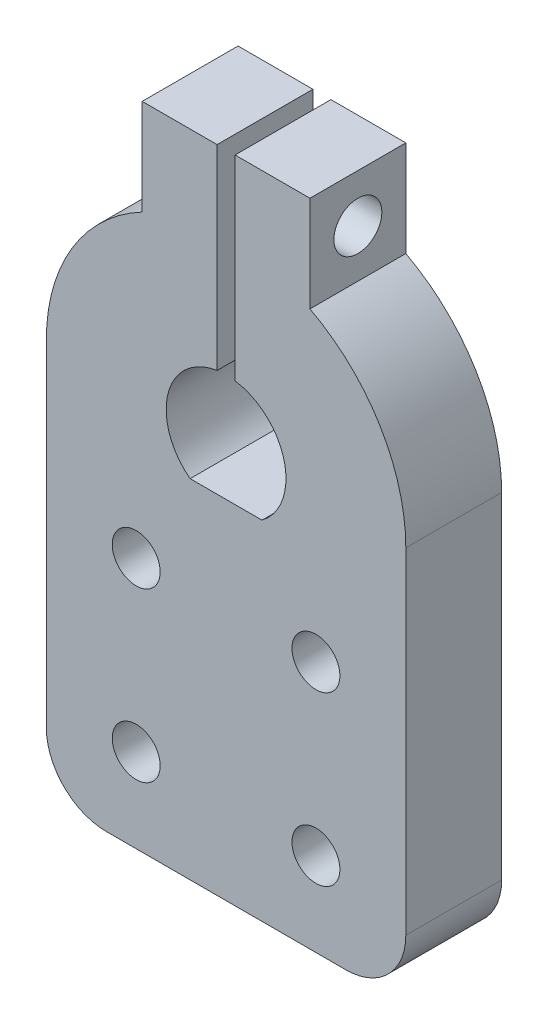
from build123d import *

# Parameters (mm, degrees)
SKETCH_1_R          = 2
EXTRUDE_1_DEPTH     = 8
SKETCH_2_R          = 2
CUT_EXTRUDE_1_DEPTH = 15
FILLET_2_R          = 5


with BuildPart() as part:
    # 草图1 → 凸台-拉伸1 (new body)
    with BuildSketch(Plane.XY):
        with BuildLine():
            Line((-15, 0), (-15, -33))
            Line((-15, -33), (15, -33))
            Line((15, -33), (15, 0))
            ThreePointArc((15, 0), (12.845232579, 7.745966692), (7, 13.266499161))
            Line((7, 13.266499161), (7, 21.266499161))
            Line((7, 21.266499161), (0.75, 21.266499161))
            Line((0.75, 21.266499161), (0.75, 4.943429983))
            ThreePointArc((0.75, 4.943429983), (4.848902965, 1.219893452), (3, -4))
            Line((3, -4), (-3, -4))
            ThreePointArc((-3, -4), (-4.848902965, 1.219893452), (-0.75, 4.943429983))
            Line((-0.75, 4.943429983), (-0.75, 21.266499161))
            Line((-0.75, 21.266499161), (-7, 21.266499161))
            Line((-7, 21.266499161), (-7, 13.266499161))
            ThreePointArc((-7, 13.266499161), (-12.845232579, 7.745966692), (-15, 0))
        make_face()
        with Locations((-7.5, -12)):
            Circle(SKETCH_1_R, mode=Mode.SUBTRACT)
        with Locations((-7.5, -26)):
            Circle(SKETCH_1_R, mode=Mode.SUBTRACT)
        with Locations(Location((7.5, -26, 0), (0, 0, 180))):
            Circle(SKETCH_1_R, mode=Mode.SUBTRACT)
        with Locations(Location((7.5, -12, 0), (0, 0, 180))):
            Circle(SKETCH_1_R, mode=Mode.SUBTRACT)
    extrude(amount=EXTRUDE_1_DEPTH)

    # 草图2 → 切除-拉伸1 (cut)
    with BuildSketch(Plane(origin=(7, 0, 0), x_dir=(0, 0, -1), z_dir=(1, 0, 0))):
        with Locations((-4, 17.266499161)):
            Circle(SKETCH_2_R)
    extrude(amount=-CUT_EXTRUDE_1_DEPTH, mode=Mode.SUBTRACT)

    # 圆角2
    fillet_2_edges = [part.edges().sort_by_distance(p)[0] for p in [
        (15, -33, 4),
        (-15, -33, 4),
    ]]
    fillet(fillet_2_edges, radius=FILLET_2_R)


solid = part.part
